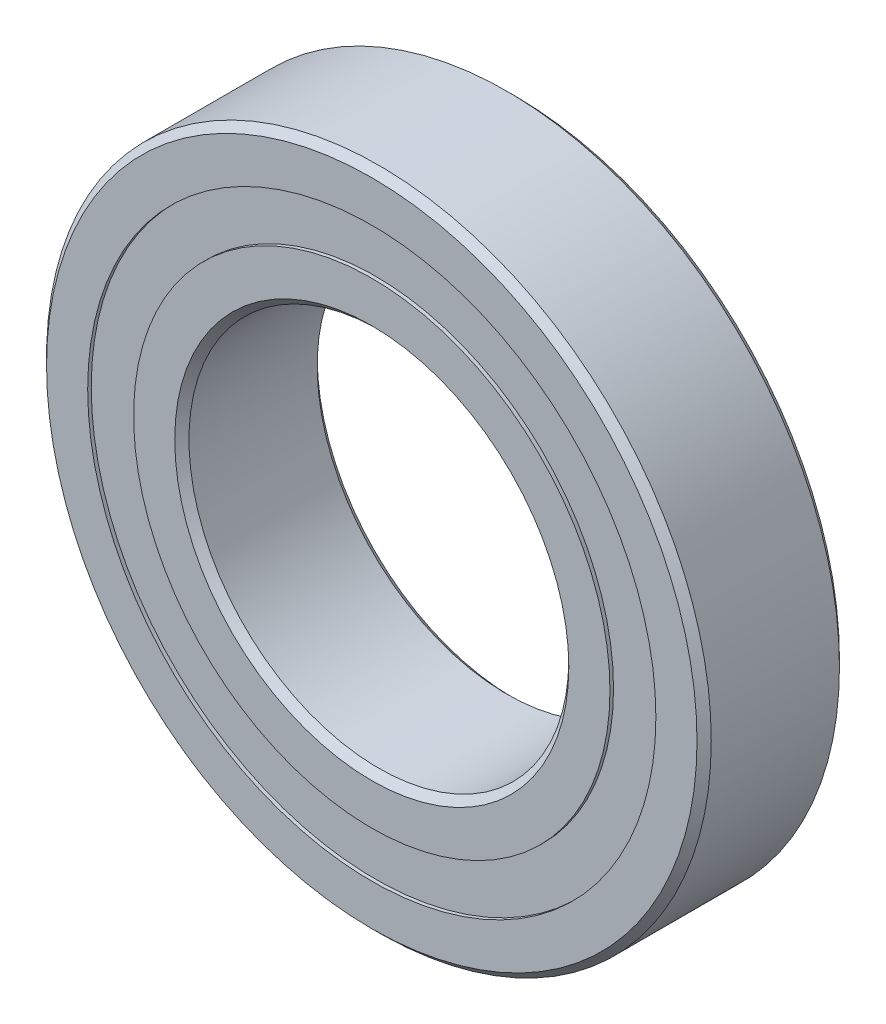
from build123d import *

# Parameters (mm, degrees)
CIRPATTERN1_COUNT = 12
SKETCH5_W         = 2.864411316
SKETCH5_H         = 4.605494506


with BuildPart() as part:
    # Sketch1 → Revolve1 (revolve)
    with BuildSketch(Plane(origin=(0, 0, 0), x_dir=(0, 0, -1), z_dir=(1, 0, 0))):
        with BuildLine():
            Line((6.429375, 33.3375), (-6.429375, 33.3375))
            Line((-6.429375, 33.3375), (-7.14375, 32.623125))
            Line((-7.14375, 32.623125), (-7.14375, 28.496497253))
            Line((-7.14375, 28.496497253), (-3.175, 28.496497253))
            ThreePointArc((-3.175, 28.496497253), (0, 30.115901184), (3.175, 28.496497253))
            Line((3.175, 28.496497253), (7.14375, 28.496497253))
            Line((7.14375, 28.496497253), (7.14375, 32.623125))
            Line((7.14375, 32.623125), (6.429375, 33.3375))
        make_face()
    revolve(axis=Axis((0, 0, 7.14375), (0, 0, -1)))


with BuildPart() as body_2:
    # Sketch3 → Revolve3 (revolve)
    with BuildSketch(Plane(origin=(0, 0, 0), x_dir=(0, 0, -1), z_dir=(1, 0, 0))):
        with BuildLine():
            Line((-7.14375, 23.891002747), (-3.175, 23.891002747))
            ThreePointArc((-3.175, 23.891002747), (0, 22.271598816), (3.175, 23.891002747))
            Line((3.175, 23.891002747), (7.14375, 23.891002747))
            Line((7.14375, 23.891002747), (7.14375, 19.764375))
            Line((7.14375, 19.764375), (6.429375, 19.05))
            Line((6.429375, 19.05), (-6.429375, 19.05))
            Line((-6.429375, 19.05), (-7.14375, 19.764375))
            Line((-7.14375, 19.764375), (-7.14375, 23.891002747))
        make_face()
    revolve(axis=Axis((0, 0, 7.14375), (0, 0, -1)))


with BuildPart() as body_3:
    # Sketch4 → Revolve4 (revolve)
    with BuildSketch(Plane(origin=(0, 0, 0), x_dir=(0, 0, -1), z_dir=(1, 0, 0))):
        with BuildLine():
            Line((-3.922151184, 26.19375), (3.922151184, 26.19375))
            ThreePointArc((3.922151184, 26.19375), (0, 30.115901184), (-3.922151184, 26.19375))
        make_face()
    revolve(axis=Axis((0, 26.19375, 3.922151184), (0, 0, -1)))


with BuildPart() as cirpattern1_1:
    # CirPattern1: pattern copy
    add(body_3.part.rotate(Axis((0, 0, -7.14375), (0, 0, 1)), 1 * 360 / CIRPATTERN1_COUNT))


with BuildPart() as cirpattern1_2:
    # CirPattern1: pattern copy
    add(body_3.part.rotate(Axis((0, 0, -7.14375), (0, 0, 1)), 2 * 360 / CIRPATTERN1_COUNT))


with BuildPart() as cirpattern1_3:
    # CirPattern1: pattern copy
    add(body_3.part.rotate(Axis((0, 0, -7.14375), (0, 0, 1)), 3 * 360 / CIRPATTERN1_COUNT))


with BuildPart() as cirpattern1_4:
    # CirPattern1: pattern copy
    add(body_3.part.rotate(Axis((0, 0, -7.14375), (0, 0, 1)), 4 * 360 / CIRPATTERN1_COUNT))


with BuildPart() as cirpattern1_5:
    # CirPattern1: pattern copy
    add(body_3.part.rotate(Axis((0, 0, -7.14375), (0, 0, 1)), 5 * 360 / CIRPATTERN1_COUNT))


with BuildPart() as cirpattern1_6:
    # CirPattern1: pattern copy
    add(body_3.part.rotate(Axis((0, 0, -7.14375), (0, 0, 1)), 6 * 360 / CIRPATTERN1_COUNT))


with BuildPart() as cirpattern1_7:
    # CirPattern1: pattern copy
    add(body_3.part.rotate(Axis((0, 0, -7.14375), (0, 0, 1)), 7 * 360 / CIRPATTERN1_COUNT))


with BuildPart() as cirpattern1_8:
    # CirPattern1: pattern copy
    add(body_3.part.rotate(Axis((0, 0, -7.14375), (0, 0, 1)), 8 * 360 / CIRPATTERN1_COUNT))


with BuildPart() as cirpattern1_9:
    # CirPattern1: pattern copy
    add(body_3.part.rotate(Axis((0, 0, -7.14375), (0, 0, 1)), 9 * 360 / CIRPATTERN1_COUNT))


with BuildPart() as cirpattern1_10:
    # CirPattern1: pattern copy
    add(body_3.part.rotate(Axis((0, 0, -7.14375), (0, 0, 1)), 10 * 360 / CIRPATTERN1_COUNT))


with BuildPart() as cirpattern1_11:
    # CirPattern1: pattern copy
    add(body_3.part.rotate(Axis((0, 0, -7.14375), (0, 0, 1)), 11 * 360 / CIRPATTERN1_COUNT))


with BuildPart() as body_15:
    # Sketch5 → Revolve5 (revolve)
    with BuildSketch(Plane(origin=(0, 0, 0), x_dir=(0, 0, -1), z_dir=(1, 0, 0))):
        with Locations((-5.354356842, 26.19375)):
            Rectangle(SKETCH5_W, SKETCH5_H)
        with Locations((5.354356842, 26.19375)):
            Rectangle(SKETCH5_W, SKETCH5_H)
    revolve(axis=Axis((0, 0, 7.14375), (0, 0, -1)))


solid = Compound([part.part, body_2.part, body_3.part, cirpattern1_1.part, cirpattern1_2.part, cirpattern1_3.part, cirpattern1_4.part, cirpattern1_5.part, cirpattern1_6.part, cirpattern1_7.part, cirpattern1_8.part, cirpattern1_9.part, cirpattern1_10.part, cirpattern1_11.part, body_15.part])
